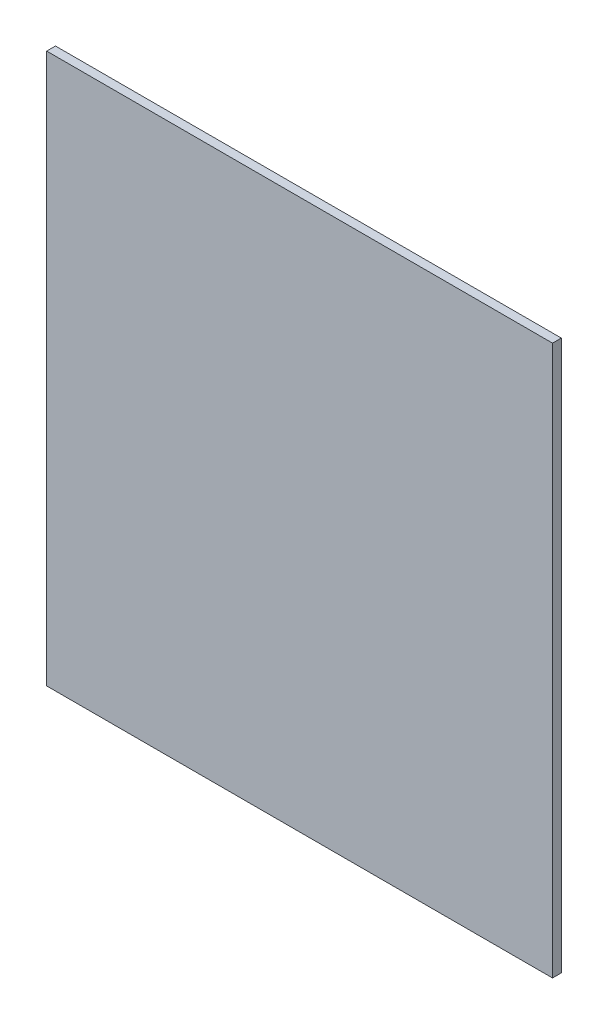
from build123d import *

# Parameters (mm, degrees)
SKETCH1_W           = 230
SKETCH1_H           = 250
BOSS_EXTRUDE1_DEPTH = 4


with BuildPart() as part:
    # Sketch1 → Boss-Extrude1 (new body)
    with BuildSketch(Plane.XY):
        Rectangle(SKETCH1_W, SKETCH1_H)
    extrude(amount=BOSS_EXTRUDE1_DEPTH)


solid = part.part
